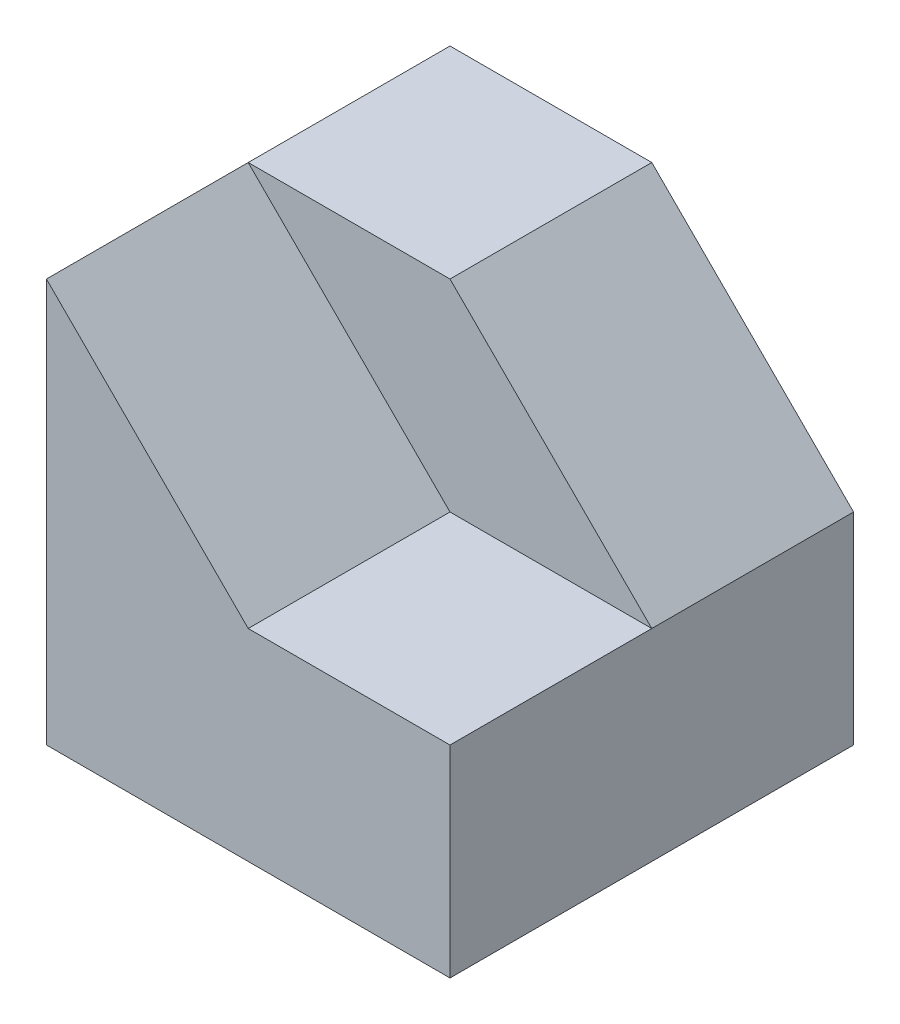
from build123d import *

# Parameters (mm, degrees)
CROQUIS1_W              = 60
CROQUIS1_H              = 60
SALIENTE_EXTRUIR1_DEPTH = 60
CROQUIS2_W              = 30
CROQUIS2_H              = 30
CORTAR_EXTRUIR1_DEPTH   = 30
CORTAR_EXTRUIR2_DEPTH   = 30
CORTAR_EXTRUIR3_DEPTH   = 30


with BuildPart() as part:
    # Croquis1 → Saliente-Extruir1 (new body)
    with BuildSketch(Plane.XY):
        with Locations((30, 30)):
            Rectangle(CROQUIS1_W, CROQUIS1_H)
    extrude(amount=-SALIENTE_EXTRUIR1_DEPTH)

    # Croquis2 → Cortar-Extruir1 (cut)
    with BuildSketch(Plane(origin=(0, 60, 0), x_dir=(1, 0, 0), z_dir=(0, 1, 0))):
        with Locations((45, 15)):
            Rectangle(CROQUIS2_W, CROQUIS2_H)
    extrude(amount=-CORTAR_EXTRUIR1_DEPTH, mode=Mode.SUBTRACT)

    # Croquis3 → Cortar-Extruir2 (cut)
    with BuildSketch(Plane.XY):
        Polygon((0, 60), (30, 30), (30, 60), align=None)
    extrude(amount=-CORTAR_EXTRUIR2_DEPTH, mode=Mode.SUBTRACT)

    # Croquis4 → Cortar-Extruir3 (cut)
    with BuildSketch(Plane.XY.offset(-30)):
        Polygon((30, 60), (60, 30), (60, 60), align=None)
    extrude(amount=-CORTAR_EXTRUIR3_DEPTH, mode=Mode.SUBTRACT)


solid = part.part
